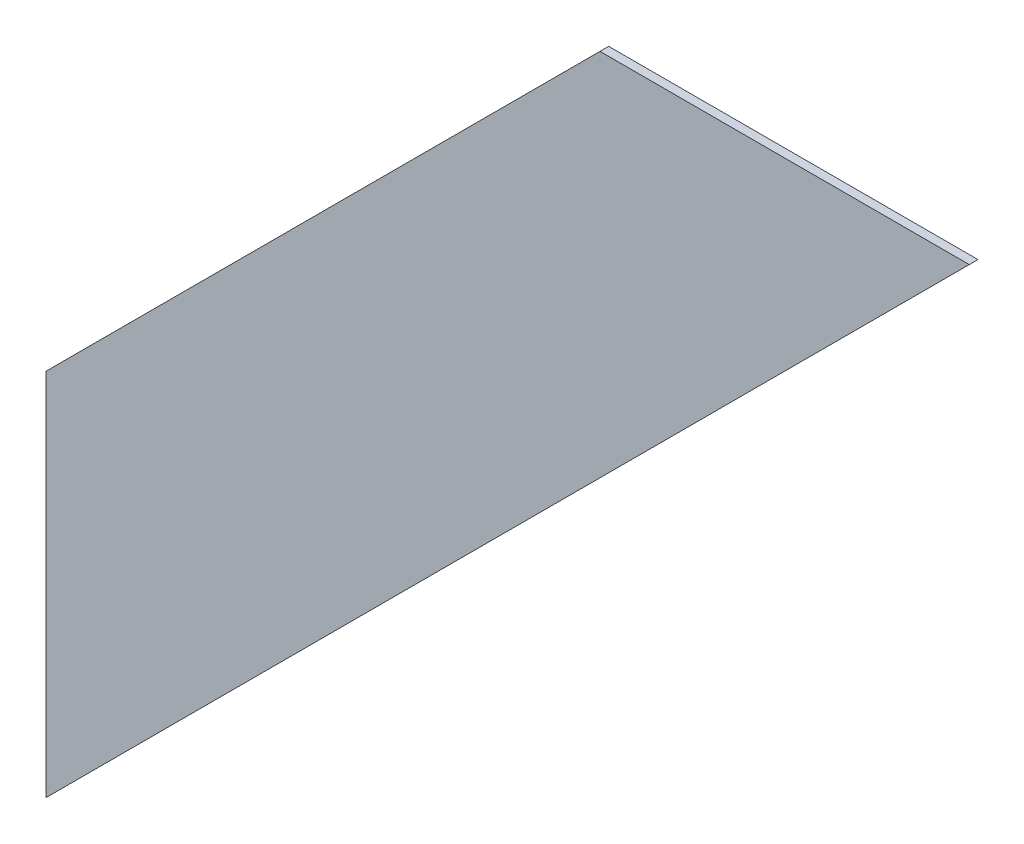
from build123d import *

# Parameters (mm, degrees)
BOSS_EXTRUDE1_DEPTH = 1


with BuildPart() as part:
    # Sketch1 → Boss-Extrude1 (new body)
    with BuildSketch(Plane.XY):
        Polygon((-29.451062124, -80.078761548), (76.614955054, 25.987255629), (34.188548183, 25.987255629), (-29.451062124, -37.652354677), align=None)
    extrude(amount=BOSS_EXTRUDE1_DEPTH)


solid = part.part
